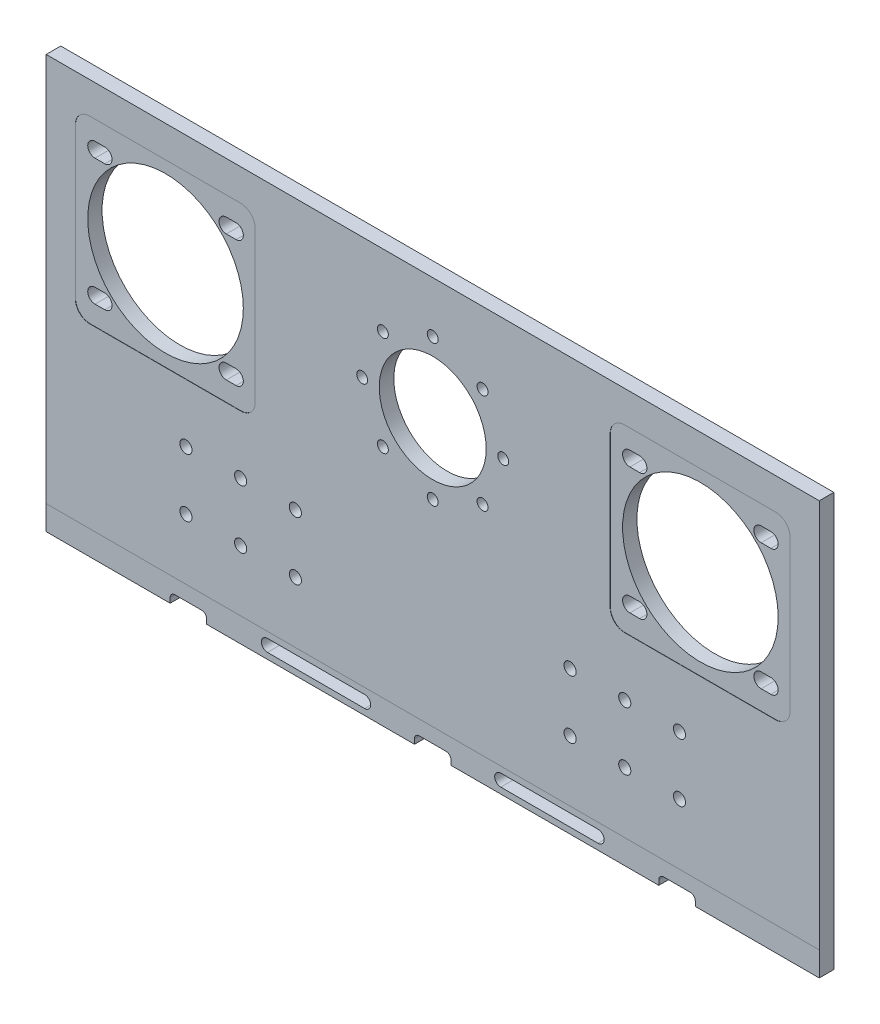
from build123d import *

# Parameters (mm, degrees)
SKIZZE1_R                       = 32
SKIZZE1_R_2                     = 22
AUFSATZ_LINEAR_AUSTRAGEN1_DEPTH = 6
SKIZZE4_R                       = 30
SCHNITT_LINEAR_AUSTRAGEN1_DEPTH = 0.1
CUT_EXTRUDE_1_DEPTH             = 264.069580964
DURCHGANGSLOCH_F_R_M41_D        = 4.5
F_5_0_5_DURCHMESSER_BOHRUNG1_D  = 5


with BuildPart() as part:
    # Skizze1 → Aufsatz-Linear austragen1 (new body)
    with BuildSketch(Plane.XY):
        with BuildLine():
            Line((84, 49.943328262), (-234, 49.943328262))
            Line((-234, 49.943328262), (-234, -120.056671738))
            Line((-234, -120.056671738), (-183, -120.056671738))
            Line((-183, -120.056671738), (-183, -118.056671738))
            ThreePointArc((-183, -118.056671738), (-182.414213562, -116.642458175), (-181, -116.056671738))
            Line((-181, -116.056671738), (-170, -116.056671738))
            ThreePointArc((-170, -116.056671738), (-168.585786438, -116.642458175), (-168, -118.056671738))
            Line((-168, -118.056671738), (-168, -120.056671738))
            Line((-168, -120.056671738), (-82.5, -120.056671738))
            Line((-82.5, -120.056671738), (-82.5, -118.056671738))
            ThreePointArc((-82.5, -118.056671738), (-81.914213562, -116.642458175), (-80.5, -116.056671738))
            Line((-80.5, -116.056671738), (-69.5, -116.056671738))
            ThreePointArc((-69.5, -116.056671738), (-68.085786438, -116.642458175), (-67.5, -118.056671738))
            Line((-67.5, -118.056671738), (-67.5, -120.056671738))
            Line((-67.5, -120.056671738), (18, -120.056671738))
            Line((18, -120.056671738), (18, -118.056671738))
            ThreePointArc((18, -118.056671738), (18.585786438, -116.642458175), (20, -116.056671738))
            Line((20, -116.056671738), (31, -116.056671738))
            ThreePointArc((31, -116.056671738), (32.414213562, -116.642458175), (33, -118.056671738))
            Line((33, -118.056671738), (33, -120.056671738))
            Line((33, -120.056671738), (84, -120.056671738))
            Line((84, -120.056671738), (84, 49.943328262))
        make_face()
        with BuildLine():
            Line((-143, -112.556671738), (-103, -112.556671738))
            ThreePointArc((-103, -112.556671738), (-100.5, -115.056671738), (-103, -117.556671738))
            Line((-103, -117.556671738), (-143, -117.556671738))
            ThreePointArc((-143, -117.556671738), (-145.5, -115.056671738), (-143, -112.556671738))
        make_face(mode=Mode.SUBTRACT)
        with BuildLine():
            Line((-7, -117.556671738), (-47, -117.556671738))
            ThreePointArc((-47, -117.556671738), (-49.5, -115.056671738), (-47, -112.556671738))
            Line((-47, -112.556671738), (-7, -112.556671738))
            ThreePointArc((-7, -112.556671738), (-4.5, -115.056671738), (-7, -117.556671738))
        make_face(mode=Mode.SUBTRACT)
        with Locations((-185, -0.056671738)):
            Circle(SKIZZE1_R, mode=Mode.SUBTRACT)
        with Locations((-75, -0.056671738)):
            Circle(SKIZZE1_R_2, mode=Mode.SUBTRACT)
        with Locations((35, -0.056671738)):
            Circle(SKIZZE1_R, mode=Mode.SUBTRACT)
    extrude(amount=AUFSATZ_LINEAR_AUSTRAGEN1_DEPTH)

    # Skizze4 → Schnitt-Linear austragen1 (cut)
    # profile 1 of 2: a face of its own
    with BuildSketch(Plane.XY.offset(6)):
        with BuildLine():
            Line((66, -37.056671738), (4, -37.056671738))
            ThreePointArc((4, -37.056671738), (-0.242640687, -35.299312425), (-2, -31.056671738))
            Line((-2, -31.056671738), (-2, 30.943328262))
            ThreePointArc((-2, 30.943328262), (-0.242640687, 35.185968949), (4, 36.943328262))
            Line((4, 36.943328262), (35, 36.943328262))
            Line((35, 36.943328262), (66, 36.943328262))
            ThreePointArc((66, 36.943328262), (70.242640687, 35.185968949), (72, 30.943328262))
            Line((72, 30.943328262), (72, -31.056671738))
            ThreePointArc((72, -31.056671738), (70.242640687, -35.299312425), (66, -37.056671738))
        make_face()
        with Locations((35, -0.056671738)):
            Circle(SKIZZE4_R, mode=Mode.SUBTRACT)
        with BuildLine():
            Line((64, 22.943328262), (60, 22.943328262))
            ThreePointArc((60, 22.943328262), (57, 25.943328262), (60, 28.943328262))
            Line((60, 28.943328262), (64, 28.943328262))
            ThreePointArc((64, 28.943328262), (67, 25.943328262), (64, 22.943328262))
        make_face(mode=Mode.SUBTRACT)
        with BuildLine():
            Line((10, 28.943328262), (6, 28.943328262))
            ThreePointArc((6, 28.943328262), (3, 25.943328262), (6, 22.943328262))
            Line((6, 22.943328262), (10, 22.943328262))
            ThreePointArc((10, 22.943328262), (13, 25.943328262), (10, 28.943328262))
        make_face(mode=Mode.SUBTRACT)
        with BuildLine():
            Line((10, -29.056671738), (6, -29.056671738))
            ThreePointArc((6, -29.056671738), (3, -26.056671738), (6, -23.056671738))
            Line((6, -23.056671738), (10, -23.056671738))
            ThreePointArc((10, -23.056671738), (13, -26.056671738), (10, -29.056671738))
        make_face(mode=Mode.SUBTRACT)
        with BuildLine():
            Line((60, -29.056671738), (64, -29.056671738))
            ThreePointArc((64, -29.056671738), (67, -26.056671738), (64, -23.056671738))
            Line((64, -23.056671738), (60, -23.056671738))
            ThreePointArc((60, -23.056671738), (57, -26.056671738), (60, -29.056671738))
        make_face(mode=Mode.SUBTRACT)
    # profile 2 of 2: a face of its own
    with BuildSketch(Plane.XY.offset(6)):
        with BuildLine():
            Line((-185, 36.943328262), (-216, 36.943328262))
            ThreePointArc((-216, 36.943328262), (-220.242640687, 35.185968949), (-222, 30.943328262))
            Line((-222, 30.943328262), (-222, -31.056671738))
            ThreePointArc((-222, -31.056671738), (-220.242640687, -35.299312425), (-216, -37.056671738))
            Line((-216, -37.056671738), (-154, -37.056671738))
            ThreePointArc((-154, -37.056671738), (-149.757359313, -35.299312425), (-148, -31.056671738))
            Line((-148, -31.056671738), (-148, 30.943328262))
            ThreePointArc((-148, 30.943328262), (-149.757359313, 35.185968949), (-154, 36.943328262))
            Line((-154, 36.943328262), (-185, 36.943328262))
        make_face()
        with Locations((-185, -0.056671738)):
            Circle(SKIZZE4_R, mode=Mode.SUBTRACT)
        with BuildLine():
            Line((-214, -23.056671738), (-210, -23.056671738))
            ThreePointArc((-210, -23.056671738), (-207, -26.056671738), (-210, -29.056671738))
            Line((-210, -29.056671738), (-214, -29.056671738))
            ThreePointArc((-214, -29.056671738), (-217, -26.056671738), (-214, -23.056671738))
        make_face(mode=Mode.SUBTRACT)
        with BuildLine():
            Line((-210, 28.943328262), (-214, 28.943328262))
            ThreePointArc((-214, 28.943328262), (-217, 25.943328262), (-214, 22.943328262))
            Line((-214, 22.943328262), (-210, 22.943328262))
            ThreePointArc((-210, 22.943328262), (-207, 25.943328262), (-210, 28.943328262))
        make_face(mode=Mode.SUBTRACT)
        with BuildLine():
            Line((-156, -23.056671738), (-160, -23.056671738))
            ThreePointArc((-160, -23.056671738), (-163, -26.056671738), (-160, -29.056671738))
            Line((-160, -29.056671738), (-156, -29.056671738))
            ThreePointArc((-156, -29.056671738), (-153, -26.056671738), (-156, -23.056671738))
        make_face(mode=Mode.SUBTRACT)
        with BuildLine():
            Line((-156, 22.943328262), (-160, 22.943328262))
            ThreePointArc((-160, 22.943328262), (-163, 25.943328262), (-160, 28.943328262))
            Line((-160, 28.943328262), (-156, 28.943328262))
            ThreePointArc((-156, 28.943328262), (-153, 25.943328262), (-156, 22.943328262))
        make_face(mode=Mode.SUBTRACT)
    extrude(amount=-SCHNITT_LINEAR_AUSTRAGEN1_DEPTH, mode=Mode.SUBTRACT)

    # Эскиз2 → Вырез-Вытянуть1 (cut, through all)
    with BuildSketch(Plane.XY.offset(6)):
        with BuildLine():
            Line((-214, -29.056671738), (-210, -29.056671738))
            ThreePointArc((-210, -29.056671738), (-207, -26.056671738), (-210, -23.056671738))
            Line((-210, -23.056671738), (-214, -23.056671738))
            ThreePointArc((-214, -23.056671738), (-217, -26.056671738), (-214, -29.056671738))
        make_face()
        with BuildLine():
            Line((-160, -29.056671738), (-156, -29.056671738))
            ThreePointArc((-156, -29.056671738), (-153, -26.056671738), (-156, -23.056671738))
            Line((-156, -23.056671738), (-160, -23.056671738))
            ThreePointArc((-160, -23.056671738), (-163, -26.056671738), (-160, -29.056671738))
        make_face()
        with BuildLine():
            Line((-156, 28.943328262), (-160, 28.943328262))
            ThreePointArc((-160, 28.943328262), (-163, 25.943328262), (-160, 22.943328262))
            Line((-160, 22.943328262), (-156, 22.943328262))
            ThreePointArc((-156, 22.943328262), (-153, 25.943328262), (-156, 28.943328262))
        make_face()
        with BuildLine():
            Line((-214, 22.943328262), (-210, 22.943328262))
            ThreePointArc((-210, 22.943328262), (-207, 25.943328262), (-210, 28.943328262))
            Line((-210, 28.943328262), (-214, 28.943328262))
            ThreePointArc((-214, 28.943328262), (-217, 25.943328262), (-214, 22.943328262))
        make_face()
        with BuildLine():
            Line((6, 22.943328262), (10, 22.943328262))
            ThreePointArc((10, 22.943328262), (13, 25.943328262), (10, 28.943328262))
            Line((10, 28.943328262), (6, 28.943328262))
            ThreePointArc((6, 28.943328262), (3, 25.943328262), (6, 22.943328262))
        make_face()
        with BuildLine():
            Line((64, 28.943328262), (60, 28.943328262))
            ThreePointArc((60, 28.943328262), (57, 25.943328262), (60, 22.943328262))
            Line((60, 22.943328262), (64, 22.943328262))
            ThreePointArc((64, 22.943328262), (67, 25.943328262), (64, 28.943328262))
        make_face()
        with BuildLine():
            Line((64, -23.056671738), (60, -23.056671738))
            ThreePointArc((60, -23.056671738), (57, -26.056671738), (60, -29.056671738))
            Line((60, -29.056671738), (64, -29.056671738))
            ThreePointArc((64, -29.056671738), (67, -26.056671738), (64, -23.056671738))
        make_face()
        with BuildLine():
            Line((10, -23.056671738), (6, -23.056671738))
            ThreePointArc((6, -23.056671738), (3, -26.056671738), (6, -29.056671738))
            Line((6, -29.056671738), (10, -29.056671738))
            ThreePointArc((10, -29.056671738), (13, -26.056671738), (10, -23.056671738))
        make_face()
    extrude(amount=-CUT_EXTRUDE_1_DEPTH, mode=Mode.SUBTRACT)

    # Durchgangsloch für M41 (through all)
    with Locations(Plane(origin=(0, 0, 0), x_dir=(-1, 0, 0), z_dir=(0, 0, -1))):
        with Locations((75, 28.943328262), (95.506096654, 20.449424917), (104, -0.056671738), (95.506096654, -20.562768392), (75, -29.056671738), (54.493903346, -20.562768392), (46, -0.056671738), (54.493903346, 20.449424917)):
            Hole(DURCHGANGSLOCH_F_R_M41_D / 2)

    # Ø5.0 (5) Durchmesser Bohrung1 (through all)
    with Locations(Plane(origin=(-176.5, -85.056671738, 6), x_dir=(1, 0, 0), z_dir=(0, 0, 1))):
        with Locations((0, 0), (0, 24), (22.5, 24), (45, 24), (45, 0), (22.5, 0), (158, 24), (180.5, 24), (203, 24), (203, 0), (180.5, 0), (158, 0)):
            Hole(F_5_0_5_DURCHMESSER_BOHRUNG1_D / 2)


solid = part.part
